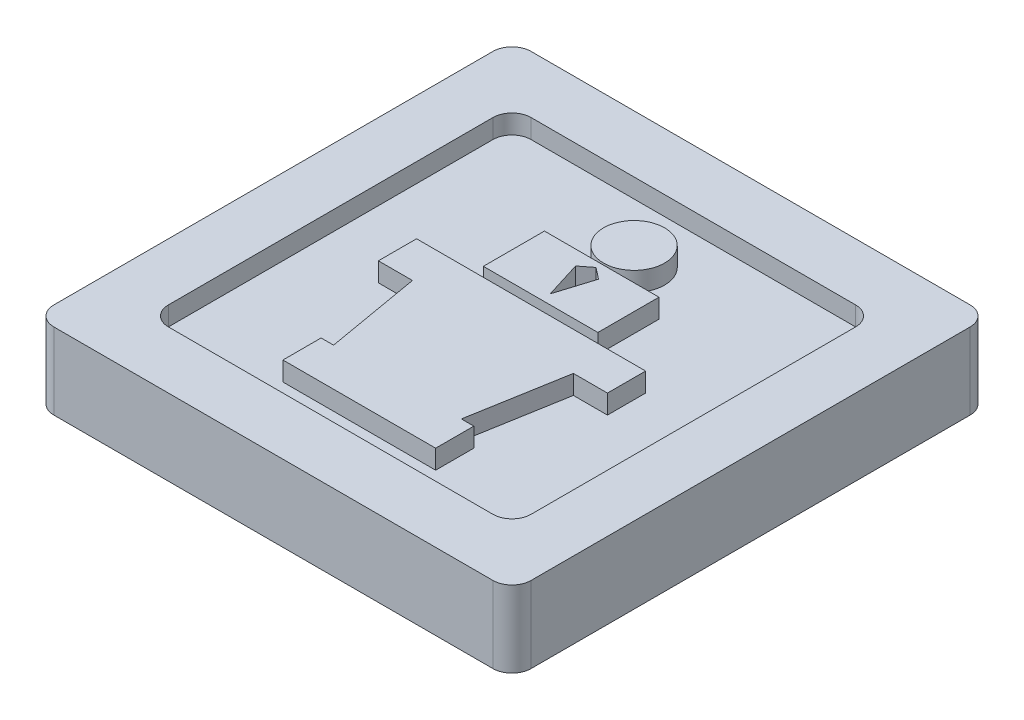
from build123d import *

# Parameters (mm, degrees)
SKETCH_1_W          = 25
SKETCH_1_H          = 25
EXTRUDE_1_DEPTH     = 4
SKETCH_2_W          = 19
SKETCH_2_H          = 19
CUT_EXTRUDE_1_DEPTH = 1
SKETCH_3_W          = 6
SKETCH_3_H          = 3.2
SKETCH_3_R          = 1.6
EXTRUDE_2_DEPTH     = 1
FILLET_1_R          = 1


with BuildPart() as part:
    # 草图1 → 凸台-拉伸1 (new body)
    with BuildSketch(Plane(origin=(0, 0, 0), x_dir=(1, 0, 0), z_dir=(0, 1, 0))):
        Rectangle(SKETCH_1_W, SKETCH_1_H)
    extrude(amount=EXTRUDE_1_DEPTH)

    # 草图2 → 切除-拉伸1 (cut)
    with BuildSketch(Plane(origin=(0, 4, 0), x_dir=(1, 0, 0), z_dir=(0, 1, 0))):
        Rectangle(SKETCH_2_W, SKETCH_2_H)
    extrude(amount=-CUT_EXTRUDE_1_DEPTH, mode=Mode.SUBTRACT)

    # 草图3 → 凸台-拉伸2 (add)
    # profile 1 of 3: a face of its own
    with BuildSketch(Plane(origin=(0, 3, 0), x_dir=(1, 0, 0), z_dir=(0, 1, 0))):
        Polygon((4.216148916, -1), (6, -1), (6, 1), (-6, 1), (-6, -1), (-4.216148916, -1), (-3.347471119, -6), (-4, -6), (-4, -8), (4, -8), (4, -6), (3.347471119, -6), align=None)
    # profile 2 of 3: a face of its own
    with BuildSketch(Plane(origin=(0, 3, 0), x_dir=(1, 0, 0), z_dir=(0, 1, 0))):
        with Locations((0, 3.1)):
            Rectangle(SKETCH_3_W, SKETCH_3_H)
        Polygon((-0.6, 3.933247604), (0, 4.4), (0.6, 3.933247604), (0, 2), align=None, mode=Mode.SUBTRACT)
    # profile 3 of 3: a face of its own
    with BuildSketch(Plane(origin=(0, 3, 0), x_dir=(1, 0, 0), z_dir=(0, 1, 0))):
        with Locations(Location((0, 6.394307769, 0), (0, 0, 270))):
            Circle(SKETCH_3_R)
    extrude(amount=EXTRUDE_2_DEPTH)

    # 圆角1
    fillet_1_edges = [part.edges().sort_by_distance(p)[0] for p in [
        (-9.5, 3.5, 9.5),
        (-9.5, 3.5, -9.5),
        (9.5, 3.5, -9.5),
        (9.5, 3.5, 9.5),
        (12.5, 2, 12.5),
        (-12.5, 2, 12.5),
        (-12.5, 2, -12.5),
        (12.5, 2, -12.5),
    ]]
    fillet(fillet_1_edges, radius=FILLET_1_R)


solid = part.part
